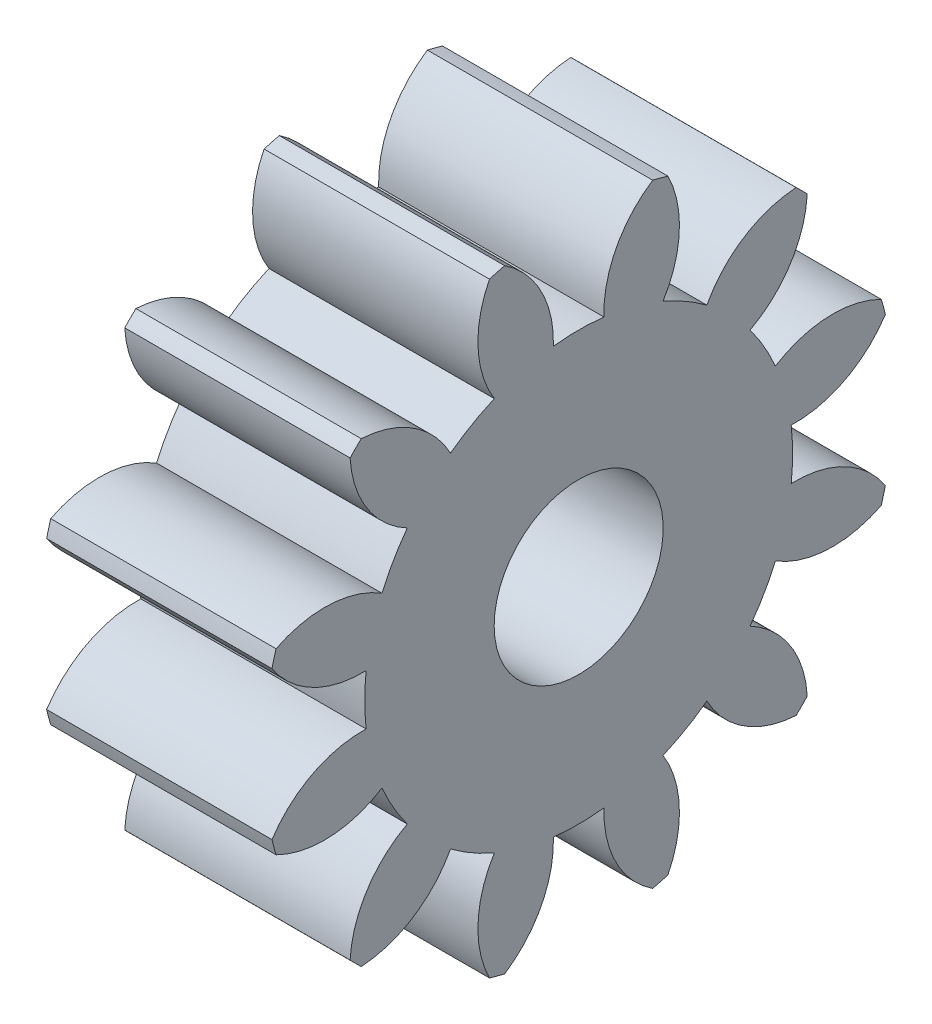
from build123d import *

# Parameters (mm, degrees)
BASPROSKE_W     = 4
BASPROSKE_H     = 5.6
TOOTHCUT_DEPTH  = 9.872429205
TEETHCUTS_COUNT = 12
TEETHCUTS_ANGLE = 330
BORSKE_R        = 1.5
BORE_DEPTH      = 50.0000508


with BuildPart() as part:
    # BasProSke → Base-Revolve (revolve)
    with BuildSketch(Plane(origin=(0, 0, 0), x_dir=(1, 0, 0), z_dir=(0, 1, 0)), mode=Mode.PRIVATE) as base_revolve_sk:
        with Locations((2, 2.8)):
            Rectangle(BASPROSKE_W, BASPROSKE_H)
    revolve(base_revolve_sk.sketch.rotate(Axis((-10, 0, 0), (1, 0, 0)), 180), axis=Axis((-10, 0, 0), (1, 0, 0)))

    # TooCutSke → ToothCut (cut, through all)
    with BuildSketch(Plane(origin=(0, 0, 0), x_dir=(0, 0, -1), z_dir=(1, 0, 0))):
        with BuildLine():
            ThreePointArc((0.449218713, 3.77234722), (0, 3.799), (-0.449218713, 3.77234722))
            ThreePointArc((-0.449218713, 3.77234722), (-0.670924606, 4.73673149), (-1.343429094, 5.462629717))
            ThreePointArc((-1.343429094, 5.462629717), (0, 5.6254), (1.343429094, 5.462629717))
            ThreePointArc((1.343429094, 5.462629717), (0.670924606, 4.73673149), (0.449218713, 3.77234722))
        make_face()
    toothcut = extrude(amount=TOOTHCUT_DEPTH, mode=Mode.SUBTRACT)

    # TeethCuts: ToothCut ×12 about axis
    teethcuts_axis = Axis((-10, 0, 0), (1, 0, 0))
    for i in range(1, TEETHCUTS_COUNT):
        add(toothcut.rotate(teethcuts_axis, i * TEETHCUTS_ANGLE / (TEETHCUTS_COUNT - 1)), mode=Mode.SUBTRACT)

    # BorSke → Bore (cut, symmetric)
    with BuildSketch(Plane(origin=(0, 0, 0), x_dir=(0, 0, -1), z_dir=(1, 0, 0))):
        with Locations(Location((0, 0, 0), (0, 0, 180))):
            Circle(BORSKE_R)
    extrude(amount=BORE_DEPTH, both=True, mode=Mode.SUBTRACT)


solid = part.part
